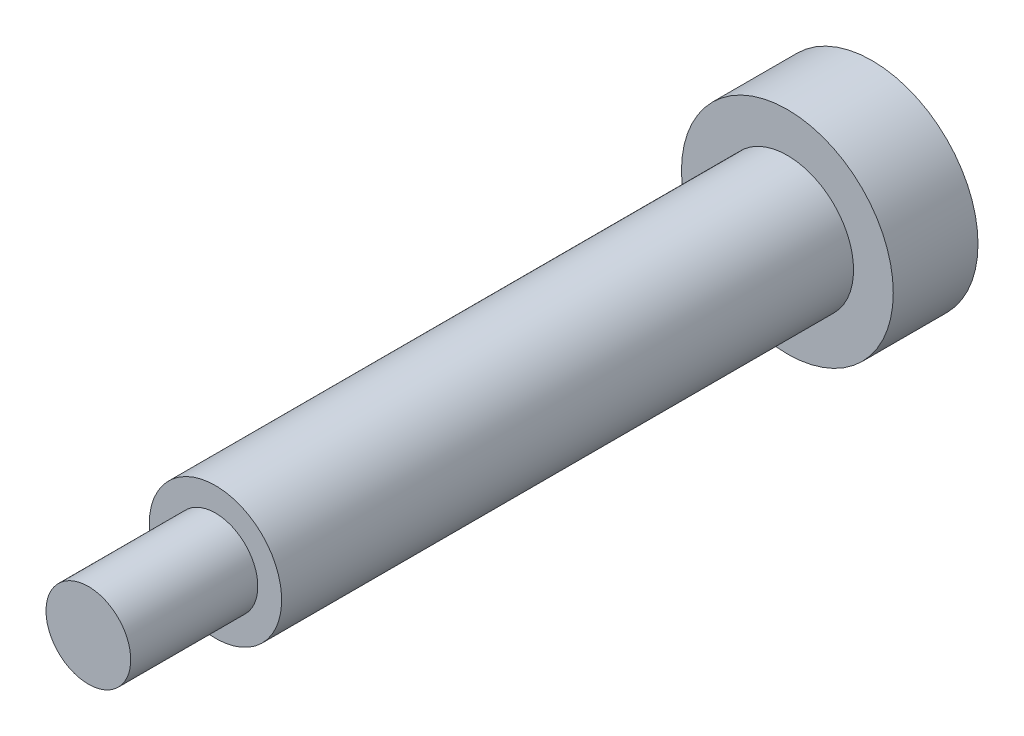
from build123d import *


with BuildPart() as part:
    # Sketch1 → Revolve1 (revolve)
    with BuildSketch(Plane(origin=(0, 0, 0), x_dir=(1, 0, 0), z_dir=(0, 1, 0)), mode=Mode.PRIVATE) as revolve1_sk:
        Polygon((0, 0), (2, 0), (2, 6), (3.125, 6), (3.125, 33), (5, 33), (5, 37), (0, 37), align=None)
    revolve(revolve1_sk.sketch.rotate(Axis((0, 0, -34.636363636), (0, 0, 1)), 180), axis=Axis((0, 0, -34.636363636), (0, 0, 1)))


solid = part.part
